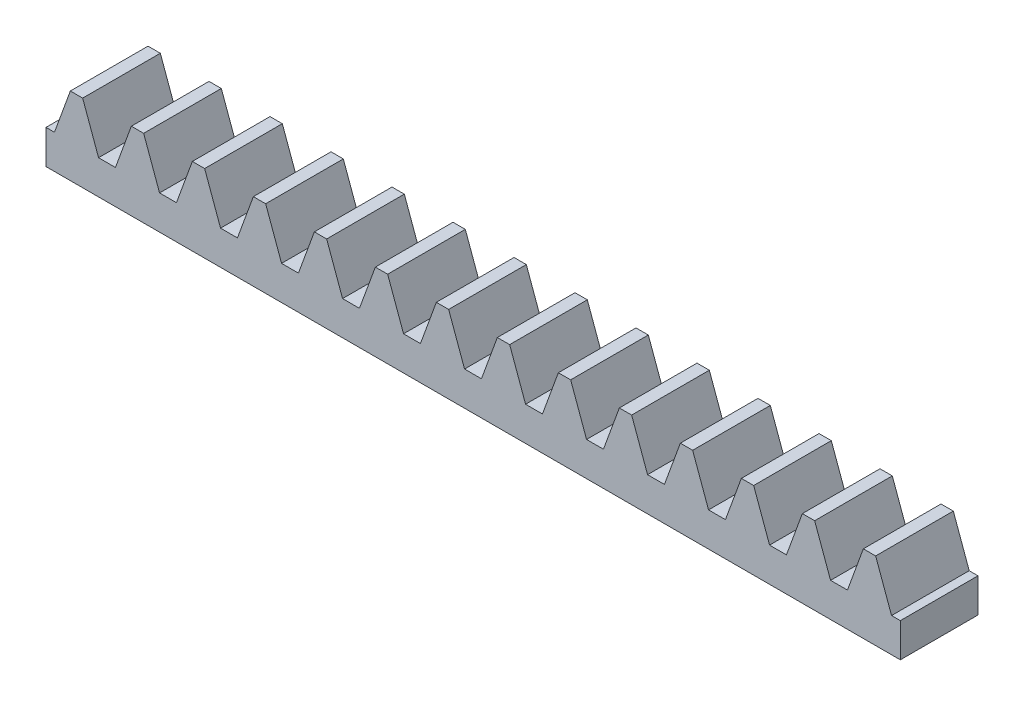
from build123d import *

# Parameters (mm, degrees)
BLANKSKE_W        = 110
BLANKSKE_H        = 10
BLANK_DEPTH       = 10
TOOTHCUTSIM_DEPTH = 111.905365064
TEETHCUTS_COUNT   = 15
TEETHCUTS_PITCH   = 7.853981625


with BuildPart() as part:
    # BlankSke → Blank (new body)
    with BuildSketch(Plane.XY):
        with Locations((55, 5)):
            Rectangle(BLANKSKE_W, BLANKSKE_H)
    extrude(amount=-BLANK_DEPTH)

    # TooCutSkeSim → ToothCutSim (cut, through all)
    with BuildSketch(Plane.XY):
        Polygon((1.087088424, 4.375), (-1.087088424, 4.375), (-3.143665836, 10.0254), (3.143665836, 10.0254), align=None)
    toothcutsim = extrude(amount=-TOOTHCUTSIM_DEPTH, mode=Mode.SUBTRACT)

    # TeethCuts: ToothCutSim ×15
    with Locations(*[(i * TEETHCUTS_PITCH, 0, 0) for i in range(1, TEETHCUTS_COUNT)]):
        add(toothcutsim, mode=Mode.SUBTRACT)


solid = part.part
